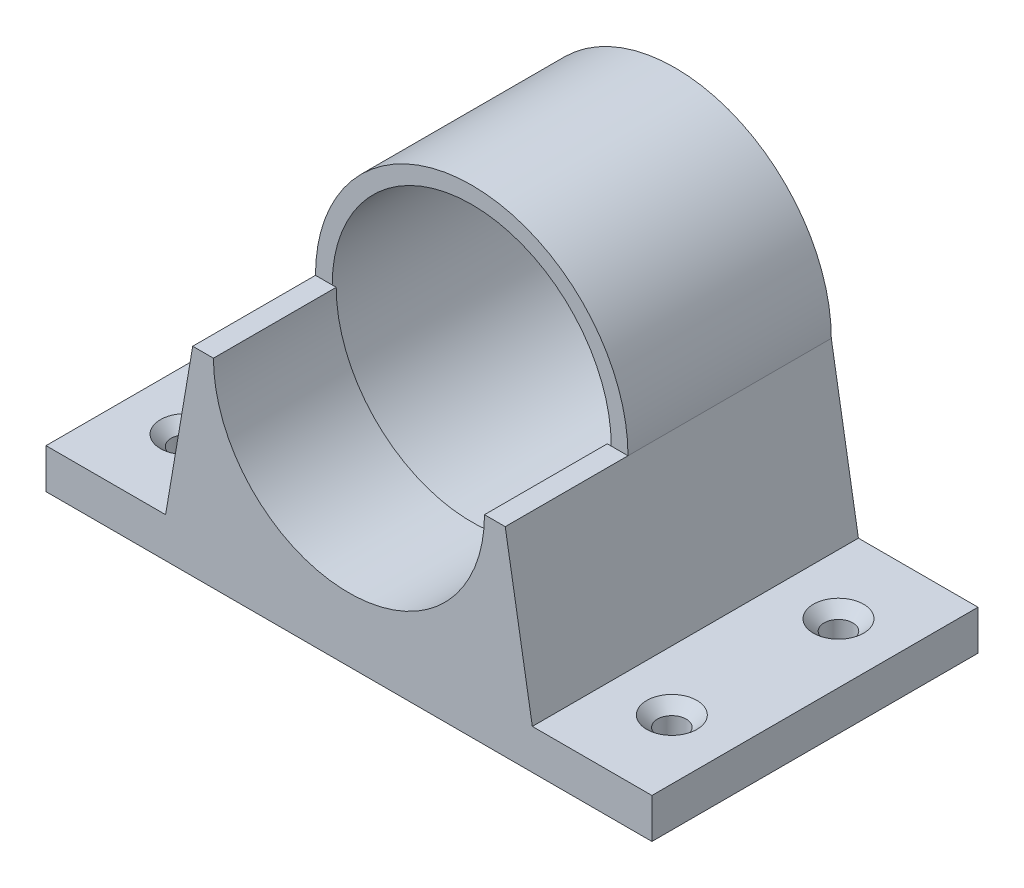
from build123d import *

# Parameters (mm, degrees)
SKETCH1_R                                       = 17.5
BOSS_EXTRUDE9_DEPTH                             = 25.5
BOSS_EXTRUDE10_DEPTH                            = 15.4
BOSS_EXTRUDE10_DEPTH_BACK                       = 25.5
CSK_FOR_M3_FLAT_HEAD_MACHINE_SCREW1_D           = 3.6
CSK_FOR_M3_FLAT_HEAD_MACHINE_SCREW1_CSINK_D     = 6.3
CSK_FOR_M3_FLAT_HEAD_MACHINE_SCREW1_CSINK_ANGLE = 90
CSK_FOR_M3_FLAT_HEAD_MACHINE_SCREW2_D           = 3.6
CSK_FOR_M3_FLAT_HEAD_MACHINE_SCREW2_CSINK_D     = 6.3
CSK_FOR_M3_FLAT_HEAD_MACHINE_SCREW2_CSINK_ANGLE = 90
BOSS_EXTRUDE11_DEPTH                            = 15.4


with BuildPart() as part:
    # Sketch1 → Boss-Extrude9 (new body)
    with BuildSketch(Plane.XY):
        with BuildLine():
            ThreePointArc((-19.6, 18.153395679), (0, 37.753395679), (19.6, 18.153395679))
            ThreePointArc((19.6, 18.153395679), (0, -1.446604321), (-19.6, 18.153395679))
        make_face()
        with Locations((0, 18.153395679)):
            Circle(SKETCH1_R, mode=Mode.SUBTRACT)
    extrude(amount=-BOSS_EXTRUDE9_DEPTH)

    # Sketch1<15> → Boss-Extrude10 (add, two sides: drawn at the far end of the back side and taken through both)
    with BuildSketch(Plane.XY.offset(-BOSS_EXTRUDE10_DEPTH_BACK)):
        with BuildLine():
            Line((-23, -1.846604321), (-38, -1.846604321))
            Line((-38, -1.846604321), (-38, -6.846604321))
            Line((-38, -6.846604321), (38, -6.846604321))
            Line((38, -6.846604321), (38, -1.846604321))
            Line((38, -1.846604321), (23, -1.846604321))
            Line((23, -1.846604321), (19.6, 18.153395679))
            ThreePointArc((19.6, 18.153395679), (0, -1.446604321), (-19.6, 18.153395679))
            Line((-19.6, 18.153395679), (-23, -1.846604321))
        make_face()
    extrude(amount=BOSS_EXTRUDE10_DEPTH + BOSS_EXTRUDE10_DEPTH_BACK)

    # CSK for M3 Flat Head Machine Screw1 (through all)
    with Locations(Plane(origin=(0, -1.846604321, 0), x_dir=(1, 0, 0), z_dir=(0, 1, 0))):
        with Locations((-30.5, 15.5), (-30.5, -5.4)):
            CounterSinkHole(CSK_FOR_M3_FLAT_HEAD_MACHINE_SCREW1_D / 2, CSK_FOR_M3_FLAT_HEAD_MACHINE_SCREW1_CSINK_D / 2, counter_sink_angle=CSK_FOR_M3_FLAT_HEAD_MACHINE_SCREW1_CSINK_ANGLE)

    # CSK for M3 Flat Head Machine Screw2 (through all)
    with Locations(Plane(origin=(0, -1.846604321, 0), x_dir=(1, 0, 0), z_dir=(0, 1, 0))):
        with Locations((30.5, -5.4), (30.5, 15.5)):
            CounterSinkHole(CSK_FOR_M3_FLAT_HEAD_MACHINE_SCREW2_D / 2, CSK_FOR_M3_FLAT_HEAD_MACHINE_SCREW2_CSINK_D / 2, counter_sink_angle=CSK_FOR_M3_FLAT_HEAD_MACHINE_SCREW2_CSINK_ANGLE)

    # Sketch1<19> → Boss-Extrude11 (add)
    with BuildSketch(Plane.XY):
        with BuildLine():
            ThreePointArc((-19.6, 18.153395679), (0, -1.446604321), (19.6, 18.153395679))
            Line((19.6, 18.153395679), (17, 18.153395679))
            ThreePointArc((17, 18.153395679), (0, 1.153395679), (-17, 18.153395679))
            Line((-17, 18.153395679), (-19.6, 18.153395679))
        make_face()
    extrude(amount=BOSS_EXTRUDE11_DEPTH)


solid = part.part
